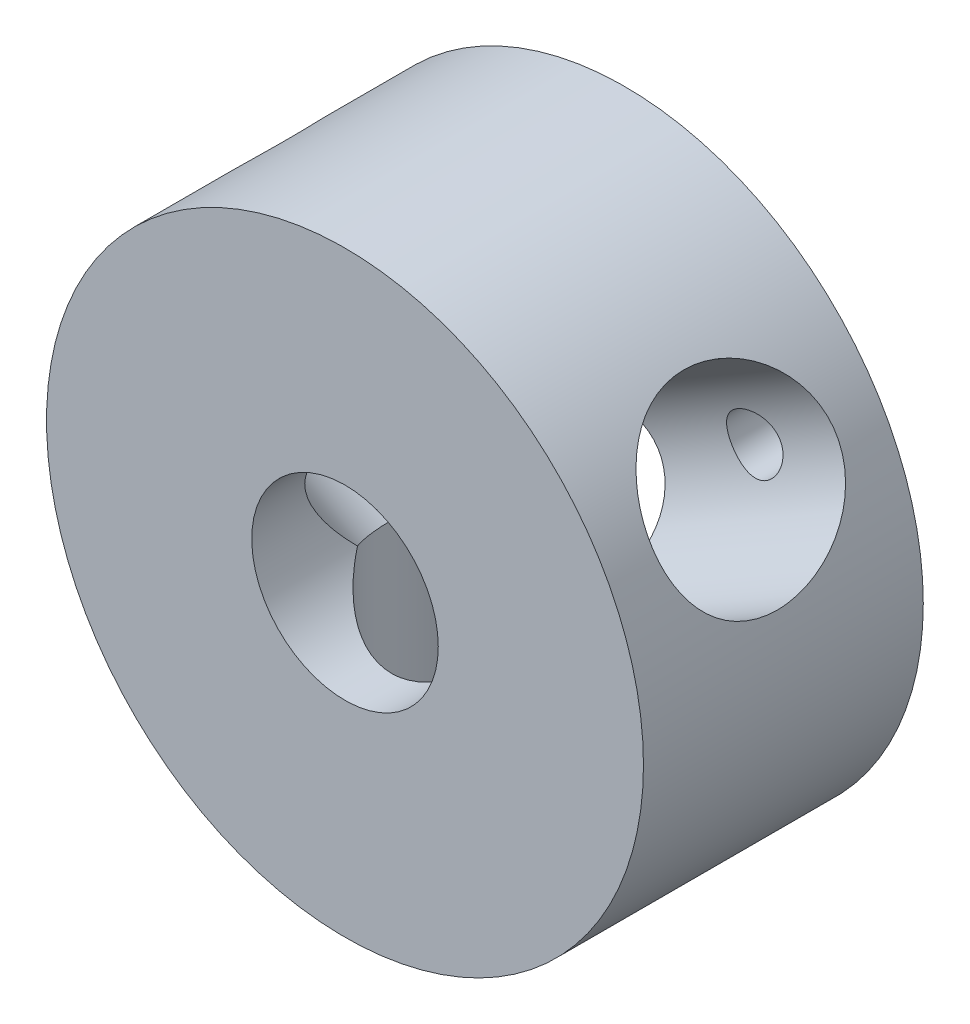
from build123d import *

# Parameters (mm, degrees)
SKETCH1_R           = 32
SKETCH1_R_2         = 10
BOSS_EXTRUDE1_DEPTH = 15
SKETCH2_R           = 10
CUT_EXTRUDE1_DEPTH  = 48.675989764
CIRPATTERN1_COUNT   = 3
SKETCH4_R           = 3
CUT_EXTRUDE3_DEPTH  = 11
CIRPATTERN2_COUNT   = 3


with BuildPart() as part:
    # Sketch1 → Boss-Extrude1 (new, symmetric)
    with BuildSketch(Plane.XY):
        Circle(SKETCH1_R)
        Circle(SKETCH1_R_2, mode=Mode.SUBTRACT)
    extrude(amount=BOSS_EXTRUDE1_DEPTH, both=True)

    # Sketch2 → Cut-Extrude1 (cut, through all)
    with BuildSketch(Plane(origin=(0, 0, 0), x_dir=(1, 0, 0), z_dir=(0, 1, 0))):
        with Locations(Location((0, 0, 0), (0, 0, 270))):
            Circle(SKETCH2_R)
    cut_extrude1 = extrude(amount=-CUT_EXTRUDE1_DEPTH, mode=Mode.SUBTRACT)

    # CirPattern1: Cut-Extrude1 ×3 about axis
    cirpattern1_axis = Axis((0, 0, 15), (0, 0, -1))
    for i in range(1, CIRPATTERN1_COUNT):
        add(cut_extrude1.rotate(cirpattern1_axis, i * 360 / CIRPATTERN1_COUNT), mode=Mode.SUBTRACT)

    # Sketch4 → Cut-Extrude3 (cut)
    with BuildSketch(Plane.XY.offset(-15)):
        with Locations(Location((0, -22, 0), (0, 0, 180))):
            Circle(SKETCH4_R)
    cut_extrude3 = extrude(amount=CUT_EXTRUDE3_DEPTH, mode=Mode.SUBTRACT)

    # CirPattern2: Cut-Extrude3 ×3 about axis
    cirpattern2_axis = Axis((0, 0, 0), (0, 0, 1))
    for i in range(1, CIRPATTERN2_COUNT):
        add(cut_extrude3.rotate(cirpattern2_axis, i * 360 / CIRPATTERN2_COUNT), mode=Mode.SUBTRACT)


solid = part.part
